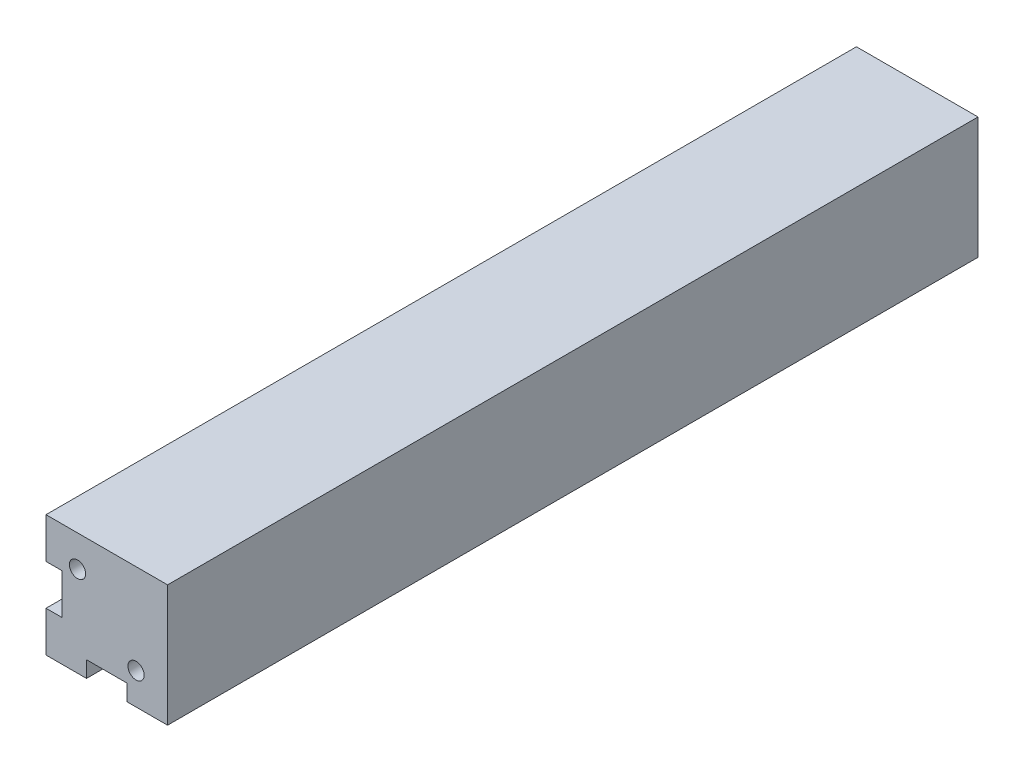
from build123d import *

# Parameters (mm, degrees)
CROQUIS1_W              = 30
CROQUIS1_H              = 30
SALIENTE_EXTRUIR1_DEPTH = 200
CROQUIS2_R              = 2
CORTAR_EXTRUIR1_DEPTH   = 25
CROQUIS4_R              = 2
CORTAR_EXTRUIR3_DEPTH   = 25
CROQUIS5_W              = 10
CROQUIS5_H              = 8
CROQUIS5_W_2            = 8
CROQUIS5_H_2            = 10
CORTAR_EXTRUIR4_DEPTH   = 200


with BuildPart() as part:
    # Croquis1 → Saliente-Extruir1 (new body)
    with BuildSketch(Plane.XY):
        Rectangle(CROQUIS1_W, CROQUIS1_H)
    extrude(amount=SALIENTE_EXTRUIR1_DEPTH)

    # Croquis2 → Cortar-Extruir1 (cut)
    with BuildSketch(Plane.XY.offset(200)):
        with Locations((-7.221825407, 7.221825407)):
            Circle(CROQUIS2_R)
        with Locations(Location((7.221825407, -7.221825407, 0), (0, 0, 180))):
            Circle(CROQUIS2_R)
    extrude(amount=-CORTAR_EXTRUIR1_DEPTH, mode=Mode.SUBTRACT)

    # Croquis4 → Cortar-Extruir3 (cut)
    with BuildSketch(Plane(origin=(0, 0, 0), x_dir=(-1, 0, 0), z_dir=(0, 0, -1))):
        Circle(CROQUIS4_R)
    extrude(amount=-CORTAR_EXTRUIR3_DEPTH, mode=Mode.SUBTRACT)

    # Croquis5 → Cortar-Extruir4 (cut)
    with BuildSketch(Plane(origin=(0, 0, 0), x_dir=(-1, 0, 0), z_dir=(0, 0, -1))):
        with Locations((0, -15)):
            Rectangle(CROQUIS5_W, CROQUIS5_H)
        with Locations((15, 0)):
            Rectangle(CROQUIS5_W_2, CROQUIS5_H_2)
    extrude(amount=-CORTAR_EXTRUIR4_DEPTH, mode=Mode.SUBTRACT)


solid = part.part
